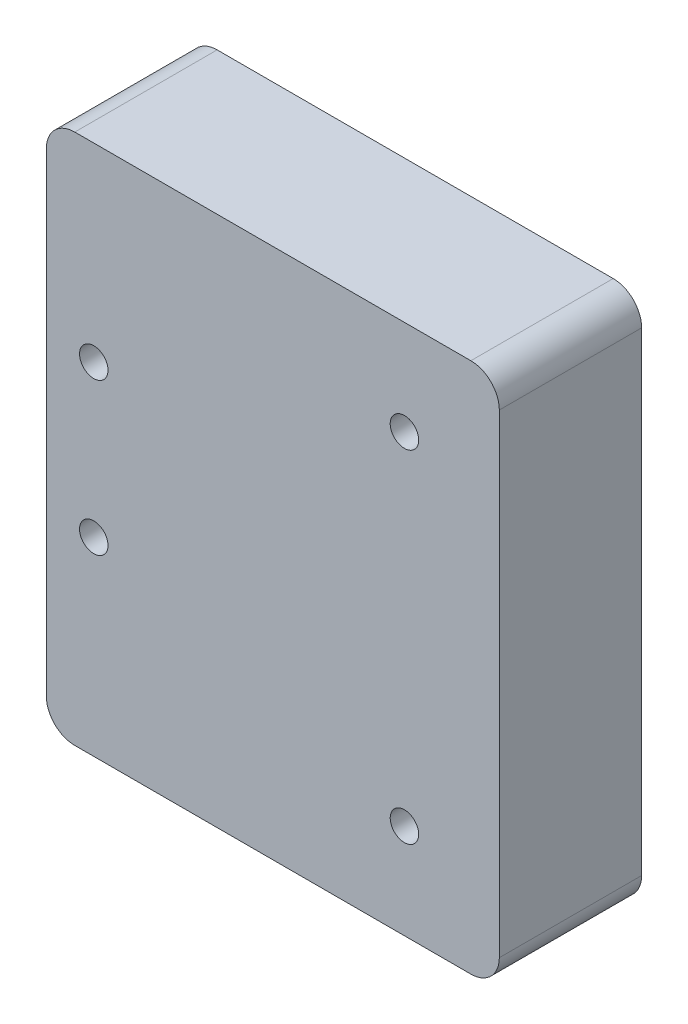
from build123d import *

# Parameters (mm, degrees)
ESQUISSE1_W             = 50
ESQUISSE1_H             = 60
BOSS_EXTRU_1_DEPTH      = 15
ESQUISSE2_R             = 4.25
ESQUISSE2_R_2           = 5
ENL_V_MAT_EXTRU_1_DEPTH = 8
ESQUISSE4_W             = 2.260138716
ESQUISSE4_H             = 60
ENL_V_MAT_EXTRU_2_DEPTH = 80.529868603
ESQUISSE5_R             = 4
ENL_V_MAT_EXTRU_3_DEPTH = 8
ESQUISSE6_W             = 47.739861284
ESQUISSE6_H             = 4.016031869
ENL_V_MAT_EXTRU_4_DEPTH = 79.128703787
CONG_1_R                = 3
ESQUISSE7_R             = 1.5
ENL_V_MAT_EXTRU_5_DEPTH = 5


with BuildPart() as part:
    # Esquisse1 → Boss.-Extru.1 (new body)
    with BuildSketch(Plane.XY):
        with Locations((25, 30)):
            Rectangle(ESQUISSE1_W, ESQUISSE1_H)
    extrude(amount=BOSS_EXTRU_1_DEPTH)

    # Esquisse2 → Enlèv. mat.-Extru.1 (cut)
    with BuildSketch(Plane.XY):
        with Locations((10, 36.14)):
            Circle(ESQUISSE2_R)
        with Locations((10, 19.84)):
            Circle(ESQUISSE2_R)
        with Locations((24.644968419, 27.99)):
            Circle(ESQUISSE2_R_2)
    extrude(amount=ENL_V_MAT_EXTRU_1_DEPTH, mode=Mode.SUBTRACT)

    # Esquisse4 → Enlèv. mat.-Extru.2 (cut, through all)
    with BuildSketch(Plane.XY):
        with Locations((48.869930642, 30)):
            Rectangle(ESQUISSE4_W, ESQUISSE4_H)
    extrude(amount=ENL_V_MAT_EXTRU_2_DEPTH, mode=Mode.SUBTRACT)

    # Esquisse5 → Enlèv. mat.-Extru.3 (cut)
    with BuildSketch(Plane(origin=(0, 0, 0), x_dir=(0, 0, -1), z_dir=(1, 0, 0))):
        with Locations((-7.779969549, 8)):
            Circle(ESQUISSE5_R)
        with Locations((-7.779969549, 48)):
            Circle(ESQUISSE5_R)
    extrude(amount=ENL_V_MAT_EXTRU_3_DEPTH, mode=Mode.SUBTRACT)

    # Esquisse6 → Enlèv. mat.-Extru.4 (cut, through all)
    with BuildSketch(Plane(origin=(0, 0, 0), x_dir=(-1, 0, 0), z_dir=(0, 0, -1))):
        with Locations((-23.869930642, 57.991984066)):
            Rectangle(ESQUISSE6_W, ESQUISSE6_H)
    extrude(amount=-ENL_V_MAT_EXTRU_4_DEPTH, mode=Mode.SUBTRACT)

    # Congé1
    cong_1_edges = [part.edges().sort_by_distance(p)[0] for p in [
        (47.739861284, 0, 7.5),
        (47.739861284, 55.983968131, 7.5),
        (0, 55.983968131, 7.5),
        (0, 0, 7.5),
    ]]
    fillet(cong_1_edges, radius=CONG_1_R)

    # Esquisse7 → Enlèv. mat.-Extru.5 (cut)
    with BuildSketch(Plane.XY.offset(15)):
        with Locations((37.739861284, 45.983968131)):
            Circle(ESQUISSE7_R)
        with Locations((37.739861284, 10)):
            Circle(ESQUISSE7_R)
        with Locations((5, 20)):
            Circle(ESQUISSE7_R)
        with Locations((5, 35.983968131)):
            Circle(ESQUISSE7_R)
    extrude(amount=-ENL_V_MAT_EXTRU_5_DEPTH, mode=Mode.SUBTRACT)


solid = part.part
